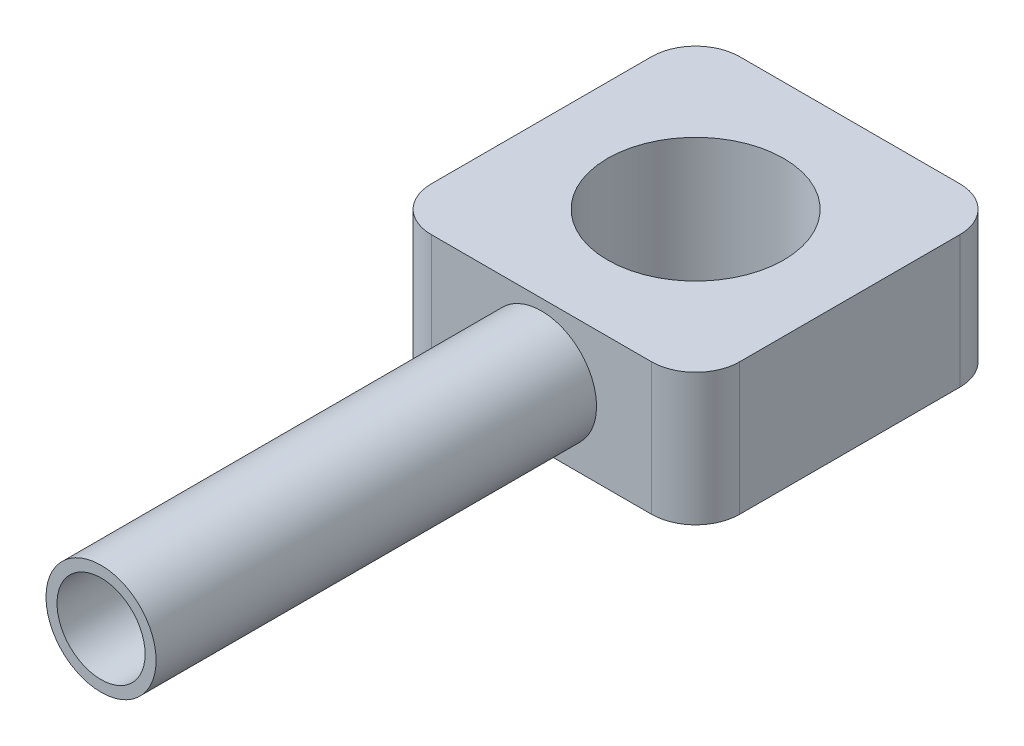
from build123d import *

# Parameters (mm, degrees)
SKETCH1_R           = 100
BOSS_EXTRUDE1_DEPTH = 150
SKETCH4_R           = 62.5
SKETCH4_R_2         = 50
BOSS_EXTRUDE3_DEPTH = 500


with BuildPart() as part:
    # Sketch1 → Boss-Extrude1 (new body)
    with BuildSketch(Plane(origin=(0, 0, 0), x_dir=(1, 0, 0), z_dir=(0, 1, 0))):
        with BuildLine():
            Line((-125, 175), (125, 175))
            ThreePointArc((125, 175), (160.355339059, 160.355339059), (175, 125))
            Line((175, 125), (175, -125))
            ThreePointArc((175, -125), (160.355339059, -160.355339059), (125, -175))
            Line((125, -175), (-125, -175))
            ThreePointArc((-125, -175), (-160.355339059, -160.355339059), (-175, -125))
            Line((-175, -125), (-175, 125))
            ThreePointArc((-175, 125), (-160.355339059, 160.355339059), (-125, 175))
        make_face()
        with Locations(Location((0, 0, 0), (0, 0, 270))):
            Circle(SKETCH1_R, mode=Mode.SUBTRACT)
    extrude(amount=BOSS_EXTRUDE1_DEPTH)

    # Sketch4 → Boss-Extrude3 (add)
    with BuildSketch(Plane.XY.offset(175)):
        with Locations(Location((0, 75, 0), (0, 0, 180))):
            Circle(SKETCH4_R)
        with Locations((0, 75)):
            Circle(SKETCH4_R_2, mode=Mode.SUBTRACT)
    extrude(amount=BOSS_EXTRUDE3_DEPTH)


solid = part.part
